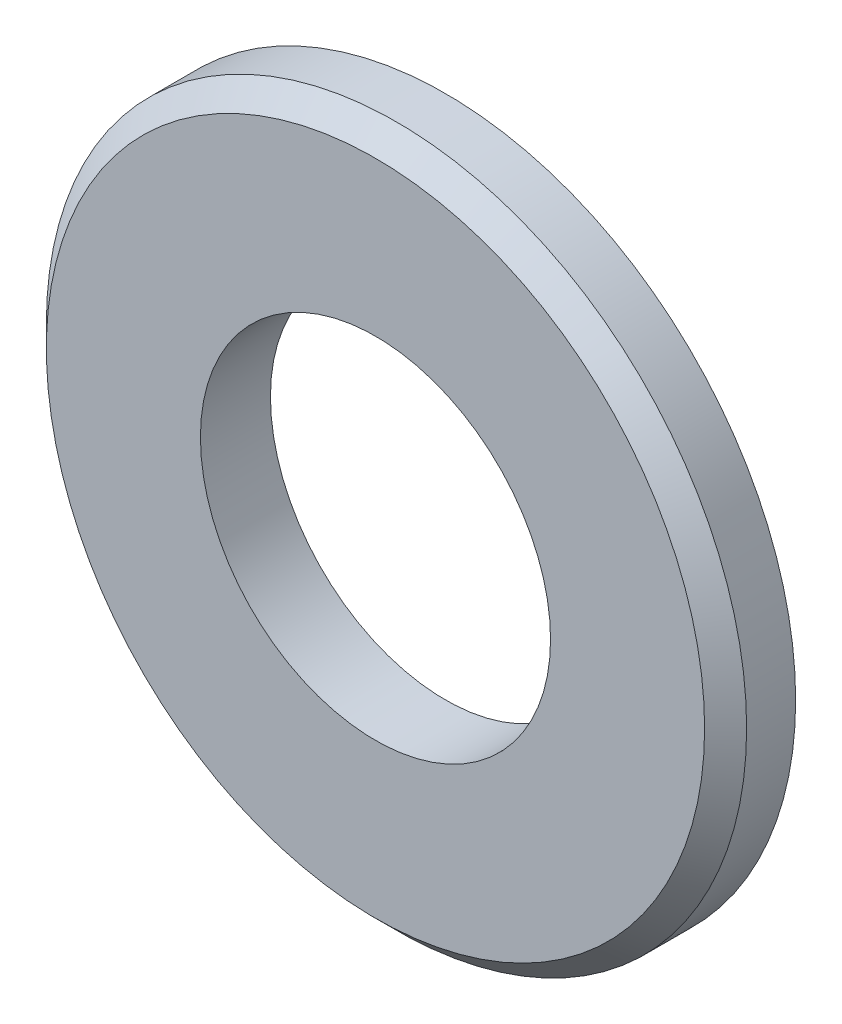
from build123d import *

# Parameters (mm, degrees)
CROQUIS1_R              = 5
CROQUIS1_R_2            = 2.5
SALIENTE_EXTRUIR1_DEPTH = 1
CHAFL_N1_SIZE           = 0.3


with BuildPart() as part:
    # Croquis1 → Saliente-Extruir1 (new body)
    with BuildSketch(Plane.XY):
        Circle(CROQUIS1_R)
        Circle(CROQUIS1_R_2, mode=Mode.SUBTRACT)
    extrude(amount=-SALIENTE_EXTRUIR1_DEPTH)

    # Chaflán1
    chafl_n1_edges = [part.edges().sort_by_distance(p)[0] for p in [
        (-5, 0, 0),
    ]]
    chamfer(chafl_n1_edges, length=CHAFL_N1_SIZE)


solid = part.part
